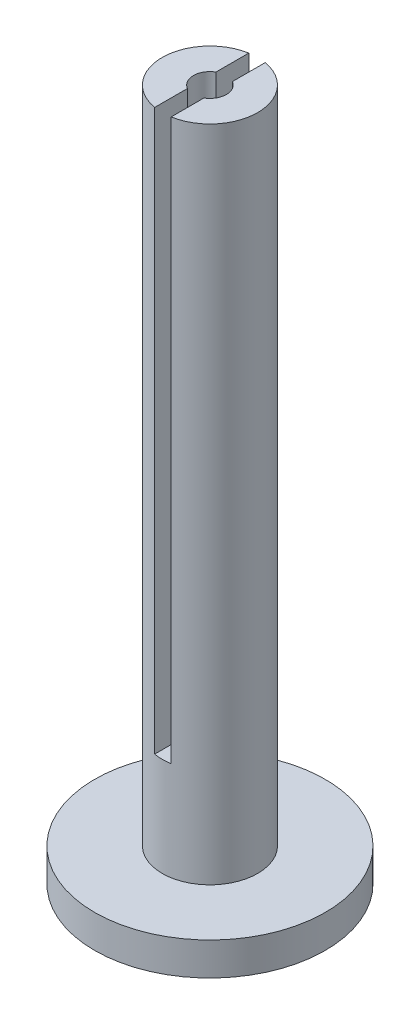
from build123d import *

# Parameters (mm, degrees)
SKIZZE1_R                       = 3.5
AUFSATZ_LINEAR_AUSTRAGEN1_DEPTH = 1
SKIZZE2_R                       = 1.45
AUFSATZ_LINEAR_AUSTRAGEN2_DEPTH = 20
SKIZZE3_W                       = 0.5
SKIZZE3_H                       = 3
SCHNITT_LINEAR_AUSTRAGEN1_DEPTH = 17
SKIZZE4_R                       = 0.5
SCHNITT_LINEAR_AUSTRAGEN2_DEPTH = 17


with BuildPart() as part:
    # Skizze1 → Aufsatz-Linear austragen1 (new body)
    with BuildSketch(Plane(origin=(0, 0, 0), x_dir=(1, 0, 0), z_dir=(0, 1, 0))):
        with Locations(Location((0, 0, 0), (0, 0, 270))):
            Circle(SKIZZE1_R)
    extrude(amount=AUFSATZ_LINEAR_AUSTRAGEN1_DEPTH)

    # Skizze2 → Aufsatz-Linear austragen2 (add)
    with BuildSketch(Plane(origin=(0, 1, 0), x_dir=(1, 0, 0), z_dir=(0, 1, 0))):
        with Locations(Location((0, 0, 0), (0, 0, 270))):
            Circle(SKIZZE2_R)
    extrude(amount=AUFSATZ_LINEAR_AUSTRAGEN2_DEPTH)

    # Skizze3 → Schnitt-Linear austragen1 (cut)
    with BuildSketch(Plane(origin=(0, 21, 0), x_dir=(1, 0, 0), z_dir=(0, 1, 0))):
        Rectangle(SKIZZE3_W, SKIZZE3_H)
    extrude(amount=-SCHNITT_LINEAR_AUSTRAGEN1_DEPTH, mode=Mode.SUBTRACT)

    # Skizze4 → Schnitt-Linear austragen2 (cut)
    with BuildSketch(Plane(origin=(0, 21, 0), x_dir=(1, 0, 0), z_dir=(0, 1, 0))):
        Circle(SKIZZE4_R)
    extrude(amount=-SCHNITT_LINEAR_AUSTRAGEN2_DEPTH, mode=Mode.SUBTRACT)


solid = part.part
